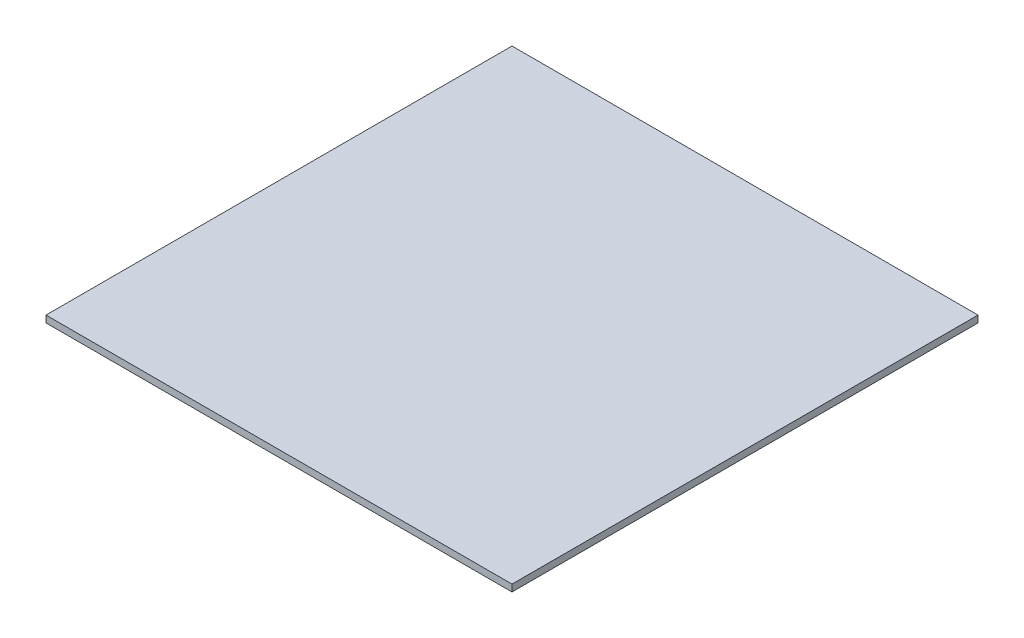
from build123d import *

# Parameters (mm, degrees)
SKETCH_1_W      = 75
SKETCH_1_H      = 75
EXTRUDE_1_DEPTH = 1.1


with BuildPart() as part:
    # 草图1 → 凸台-拉伸1 (new body)
    with BuildSketch(Plane(origin=(0, 0, 0), x_dir=(1, 0, 0), z_dir=(0, 1, 0))):
        Rectangle(SKETCH_1_W, SKETCH_1_H)
    extrude(amount=EXTRUDE_1_DEPTH)


solid = part.part
